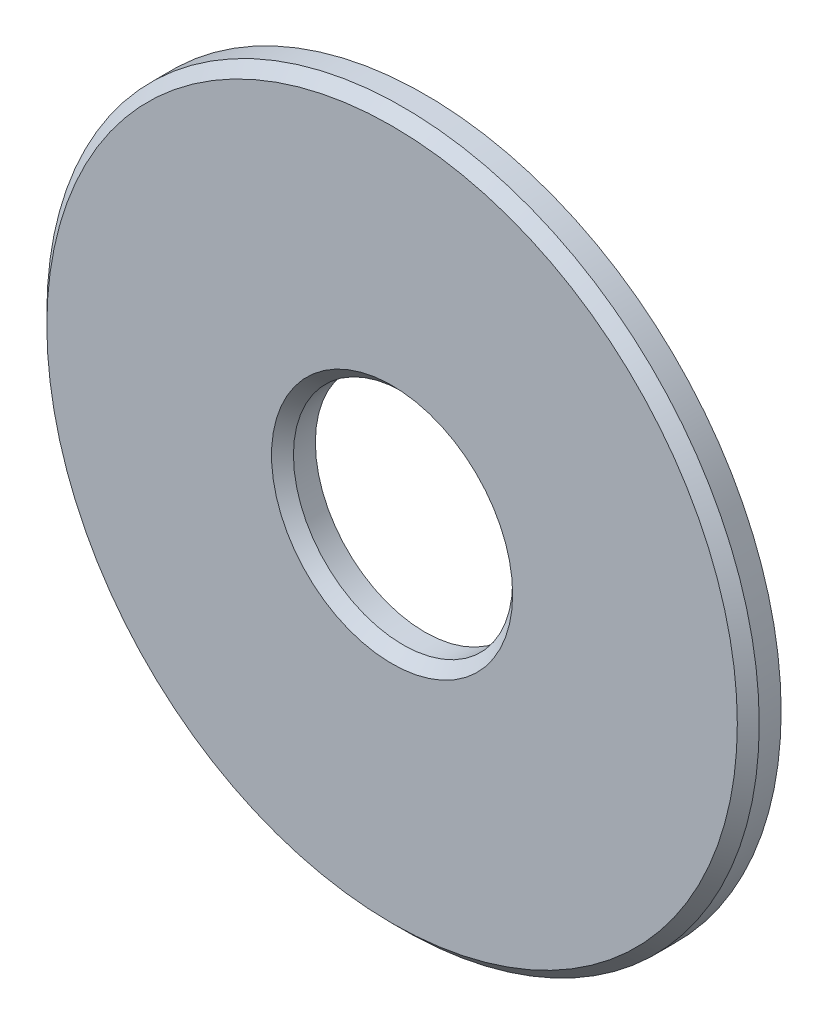
from build123d import *

# Parameters (mm, degrees)
IZIM1_R                     = 65
IZIM1_R_2                   = 20
Y_KSEKLIK_EKSTR_ZYON1_DEPTH = 6
PAH1_SIZE                   = 2


with BuildPart() as part:
    # Çizim1 → Yükseklik-Ekstrüzyon1 (new body)
    with BuildSketch(Plane.XY):
        Circle(IZIM1_R)
        Circle(IZIM1_R_2, mode=Mode.SUBTRACT)
    extrude(amount=Y_KSEKLIK_EKSTR_ZYON1_DEPTH)

    # Pah1
    pah1_edges = [part.edges().sort_by_distance(p)[0] for p in [
        (-65, 0, 6),
        (-20, 0, 6),
    ]]
    chamfer(pah1_edges, length=PAH1_SIZE)


solid = part.part
